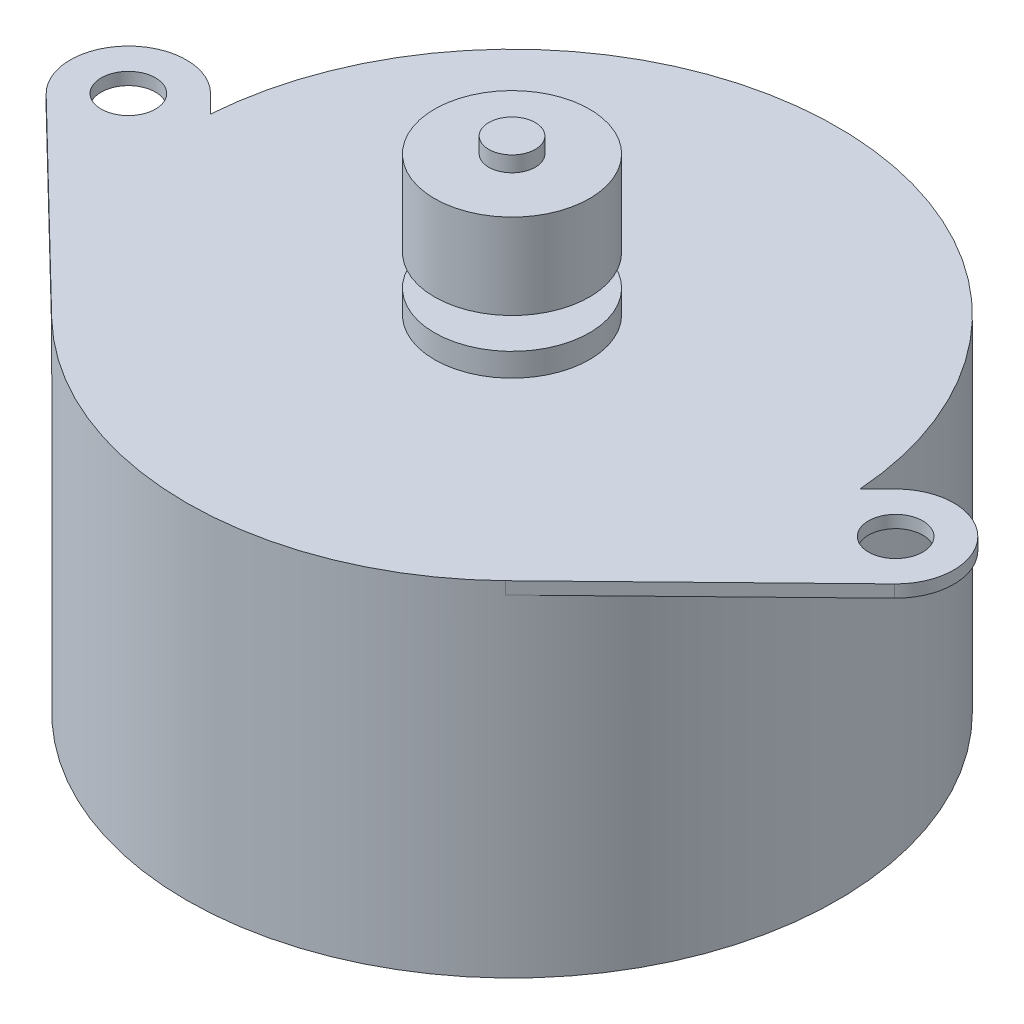
from build123d import *

# Parameters (mm, degrees)
CROQUIS1_R              = 21
SALIENTE_EXTRUIR1_DEPTH = 21.4
CROQUIS2_R              = 1.750000001
CROQUIS2_R_2            = 1.75
SALIENTE_EXTRUIR2_DEPTH = 0.8
CROQUIS3_R              = 5
SALIENTE_EXTRUIR3_DEPTH = 1.5
CROQUIS4_R              = 1.5
SALIENTE_EXTRUIR4_DEPTH = 8.5
CROQUIS5_R              = 5
CROQUIS5_R_2            = 1.5
SALIENTE_EXTRUIR5_DEPTH = 5.5
SALIENTE_EXTRUIR6_START = 1
CROQUIS6_R              = 1.5
SALIENTE_EXTRUIR6_DEPTH = 1


with BuildPart() as part:
    # Croquis1 → Saliente-Extruir1 (new body)
    with BuildSketch(Plane(origin=(0, 0, 0), x_dir=(1, 0, 0), z_dir=(0, 1, 0))):
        with Locations(Location((0, 0, 0), (0, 0, 270))):
            Circle(CROQUIS1_R)
    extrude(amount=SALIENTE_EXTRUIR1_DEPTH)

    # Croquis2 → Saliente-Extruir2 (add)
    with BuildSketch(Plane(origin=(0, 21.4, 0), x_dir=(1, 0, 0), z_dir=(0, 1, 0))):
        with BuildLine():
            Line((-27.36337, -2.691836219), (-14.634872681, -15.060561132))
            ThreePointArc((-14.634872681, -15.060561132), (0.00030013, -20.999999998), (14.635303163, -15.060142806))
            Line((14.635303163, -15.060142806), (27.363446993, -2.691054009))
            ThreePointArc((27.363446993, -2.691054009), (27.421544543, 2.629863133), (22.100355918, 2.651912466))
            Line((22.100355918, 2.651912466), (20.946382723, 1.499683579))
            ThreePointArc((20.946382723, 1.499683579), (1e-09, 21), (-20.946382722, 1.499683581))
            Line((-20.946382722, 1.499683581), (-22.101170465, 2.652018145))
            ThreePointArc((-22.101170465, 2.652018145), (-27.421985882, 2.628707389), (-27.36337, -2.691836219))
        make_face()
        with Locations(Location((24.75, -0.001742794, 0), (0, 0, 270))):
            Circle(CROQUIS2_R, mode=Mode.SUBTRACT)
        with Locations(Location((-24.749999879, -0.002450302, 0), (0, 0, 270))):
            Circle(CROQUIS2_R_2, mode=Mode.SUBTRACT)
    extrude(amount=SALIENTE_EXTRUIR2_DEPTH)

    # Croquis3 → Saliente-Extruir3 (add)
    with BuildSketch(Plane(origin=(0, 22.2, 0), x_dir=(1, 0, 0), z_dir=(0, 1, 0))):
        with Locations(Location((0, 0, 0), (0, 0, 270))):
            Circle(CROQUIS3_R)
    extrude(amount=SALIENTE_EXTRUIR3_DEPTH)

    # Croquis4 → Saliente-Extruir4 (add)
    with BuildSketch(Plane(origin=(0, 23.7, 0), x_dir=(1, 0, 0), z_dir=(0, 1, 0))):
        with Locations(Location((0, 0, 0), (0, 0, 270))):
            Circle(CROQUIS4_R)
    extrude(amount=SALIENTE_EXTRUIR4_DEPTH)

    # Croquis5 → Saliente-Extruir5 (add)
    with BuildSketch(Plane(origin=(0, 25.7, 0), x_dir=(1, 0, 0), z_dir=(0, 1, 0))):
        with Locations(Location((0, 0, 0), (0, 0, 270))):
            Circle(CROQUIS5_R)
        with Locations(Location((0, 0, 0), (0, 0, 270))):
            Circle(CROQUIS5_R_2, mode=Mode.SUBTRACT)
    extrude(amount=SALIENTE_EXTRUIR5_DEPTH)

    # Croquis6 → Saliente-Extruir6 (add)
    with BuildSketch(Plane.XZ.offset(SALIENTE_EXTRUIR6_START)):
        with Locations(Location((0, 0, 0), (0, 0, 90))):
            Circle(CROQUIS6_R)
    extrude(amount=-SALIENTE_EXTRUIR6_DEPTH)


solid = part.part
